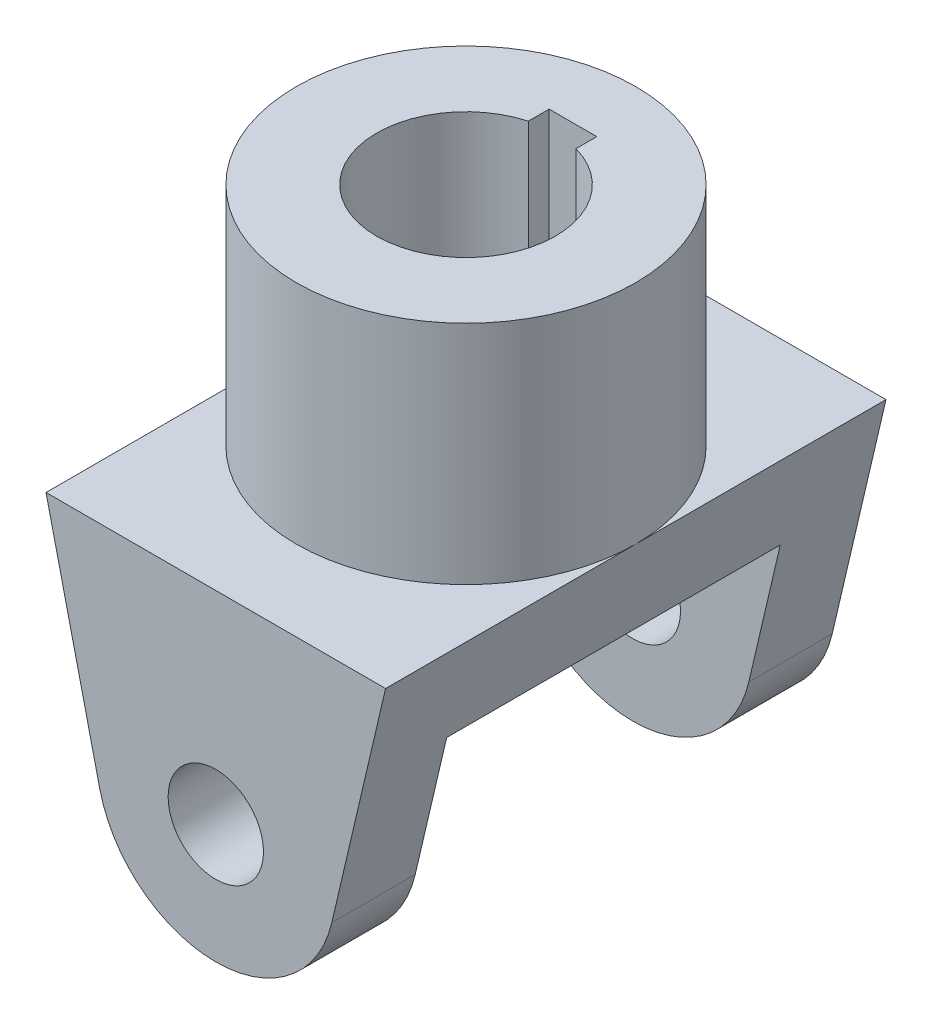
from build123d import *

# Parameters (mm, degrees)
SKETCH1_R           = 28.5
SKETCH1_R_2         = 15
BOSS_EXTRUDE1_DEPTH = 38
SKETCH2_W           = 57
SKETCH2_H           = 84
BOSS_EXTRUDE2_DEPTH = 16
SKETCH6_W           = 57
SKETCH6_H           = 38
BOSS_EXTRUDE4_DEPTH = 14
SKETCH7_W           = 57
SKETCH7_H           = 38
BOSS_EXTRUDE5_DEPTH = 14
SKETCH8_R           = 8
CUT_EXTRUDE3_DEPTH  = 104.847243584
CUT_EXTRUDE4_DEPTH  = 104.847243584
CUT_EXTRUDE5_START  = -38
CUT_EXTRUDE5_DEPTH  = 38


with BuildPart() as part:
    # Sketch1 → Boss-Extrude1 (new body)
    with BuildSketch(Plane(origin=(0, 0, 0), x_dir=(1, 0, 0), z_dir=(0, 1, 0))):
        with Locations(Location((0, 0, 0), (0, 0, 270))):
            Circle(SKETCH1_R)
        with Locations(Location((0, 0, 0), (0, 0, 270))):
            Circle(SKETCH1_R_2, mode=Mode.SUBTRACT)
    extrude(amount=BOSS_EXTRUDE1_DEPTH)

    # Sketch2 → Boss-Extrude2 (add)
    with BuildSketch(Plane.XZ):
        Rectangle(SKETCH2_W, SKETCH2_H)
    extrude(amount=BOSS_EXTRUDE2_DEPTH)

    # Sketch6 → Boss-Extrude4 (add)
    with BuildSketch(Plane.XY.offset(42)):
        with Locations((0, -35)):
            Rectangle(SKETCH6_W, SKETCH6_H)
    extrude(amount=-BOSS_EXTRUDE4_DEPTH)

    # Sketch7 → Boss-Extrude5 (add)
    with BuildSketch(Plane(origin=(0, 0, -42), x_dir=(-1, 0, 0), z_dir=(0, 0, -1))):
        with Locations((0, -35)):
            Rectangle(SKETCH7_W, SKETCH7_H)
    extrude(amount=-BOSS_EXTRUDE5_DEPTH)

    # Sketch8 → Cut-Extrude3 (cut, through all)
    with BuildSketch(Plane(origin=(0, 0, -42), x_dir=(-1, 0, 0), z_dir=(0, 0, -1))):
        with Locations((0, -34)):
            Circle(SKETCH8_R)
    extrude(amount=-CUT_EXTRUDE3_DEPTH, mode=Mode.SUBTRACT)

    # Sketch9 → Cut-Extrude4 (cut, through all)
    with BuildSketch(Plane.XY.offset(42)):
        with BuildLine():
            Line((-19.473528625, -38.558693112), (-28.5, 0))
            Line((-28.5, 0), (-28.5, -54))
            Line((-28.5, -54), (0, -54))
            ThreePointArc((0, -54), (-12.42630552, -49.671213454), (-19.473528625, -38.558693112))
        make_face()
        with BuildLine():
            ThreePointArc((19.473522225, -38.558720453), (12.426294519, -49.671222177), (0, -54))
            Line((0, -54), (28.5, -54))
            Line((28.5, -54), (28.5, 0))
            Line((28.5, 0), (19.473522225, -38.558720453))
        make_face()
    extrude(amount=-CUT_EXTRUDE4_DEPTH, mode=Mode.SUBTRACT)

    # Sketch11 → Cut-Extrude5 (cut)
    with BuildSketch(Plane(origin=(0, 38, 0), x_dir=(1, 0, 0), z_dir=(0, 1, 0)).offset(CUT_EXTRUDE5_START)):
        with BuildLine():
            Line((-4, 17.956832295), (4, 17.956832295))
            Line((4, 17.956832295), (4, 14.456832295))
            ThreePointArc((4, 14.456832295), (0, 15), (-4, 14.456832295))
            Line((-4, 14.456832295), (-4, 17.956832295))
        make_face()
    extrude(amount=CUT_EXTRUDE5_DEPTH, mode=Mode.SUBTRACT)


solid = part.part
